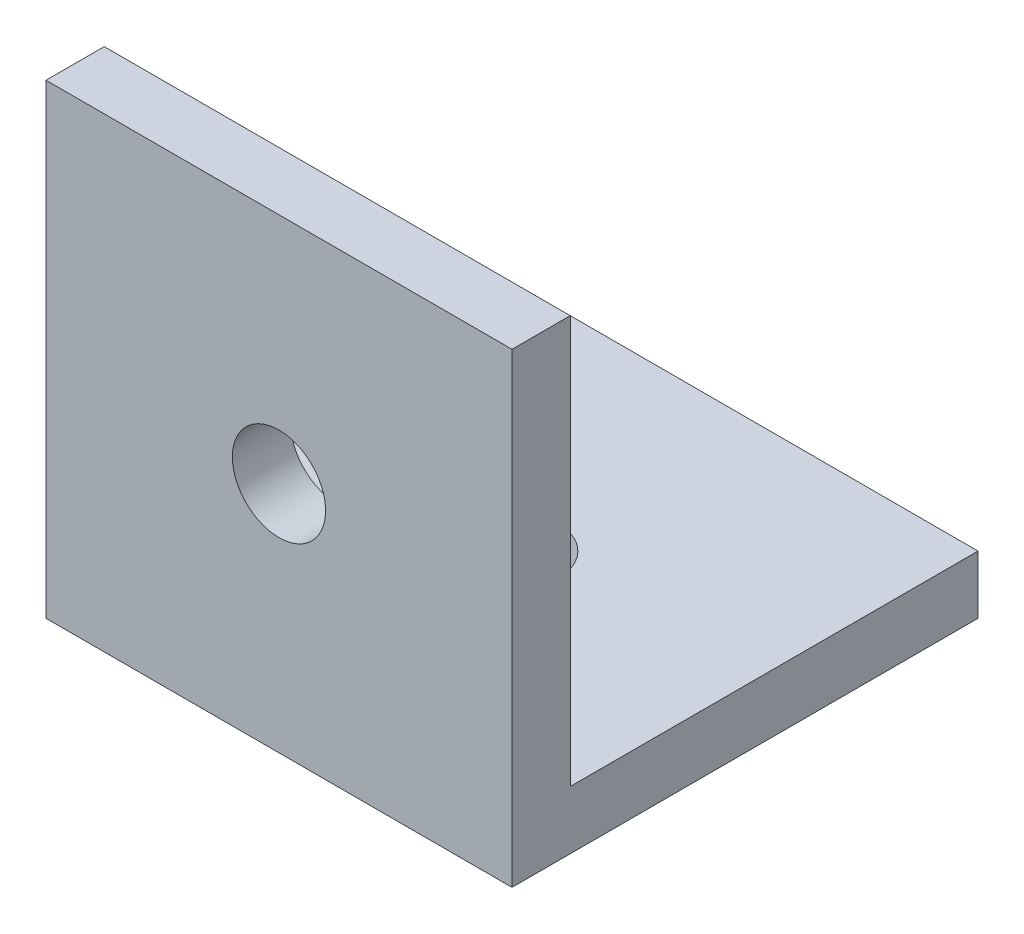
from build123d import *

# Parameters (mm, degrees)
SKETCH4_W           = 25.4
SKETCH4_H           = 25.4
BOSS_EXTRUDE3_DEPTH = 3.175
SKETCH5_W           = 25.4
SKETCH5_H           = 3.175
BOSS_EXTRUDE4_DEPTH = 22.225
SKETCH6_R           = 2.54
CUT_EXTRUDE1_DEPTH  = 34.89972345
SKETCH7_R           = 2.54
CUT_EXTRUDE2_DEPTH  = 29.575


with BuildPart() as part:
    # Sketch4 → Boss-Extrude3 (new body)
    with BuildSketch(Plane.XY):
        Rectangle(SKETCH4_W, SKETCH4_H)
    extrude(amount=BOSS_EXTRUDE3_DEPTH)

    # Sketch5 → Boss-Extrude4 (add)
    with BuildSketch(Plane(origin=(0, 0, 0), x_dir=(-1, 0, 0), z_dir=(0, 0, -1))):
        with Locations((0, -11.1125)):
            Rectangle(SKETCH5_W, SKETCH5_H)
    extrude(amount=BOSS_EXTRUDE4_DEPTH)

    # Sketch6 → Cut-Extrude1 (cut, through all)
    with BuildSketch(Plane(origin=(0, -9.525, 0), x_dir=(1, 0, 0), z_dir=(0, 1, 0))):
        with Locations(Location((0, 9.525, 0), (0, 0, 270))):
            Circle(SKETCH6_R)
    extrude(amount=-CUT_EXTRUDE1_DEPTH, mode=Mode.SUBTRACT)

    # Sketch7 → Cut-Extrude2 (cut, through all)
    with BuildSketch(Plane(origin=(0, 0, 0), x_dir=(-1, 0, 0), z_dir=(0, 0, -1))):
        Circle(SKETCH7_R)
    extrude(amount=-CUT_EXTRUDE2_DEPTH, mode=Mode.SUBTRACT)


solid = part.part
